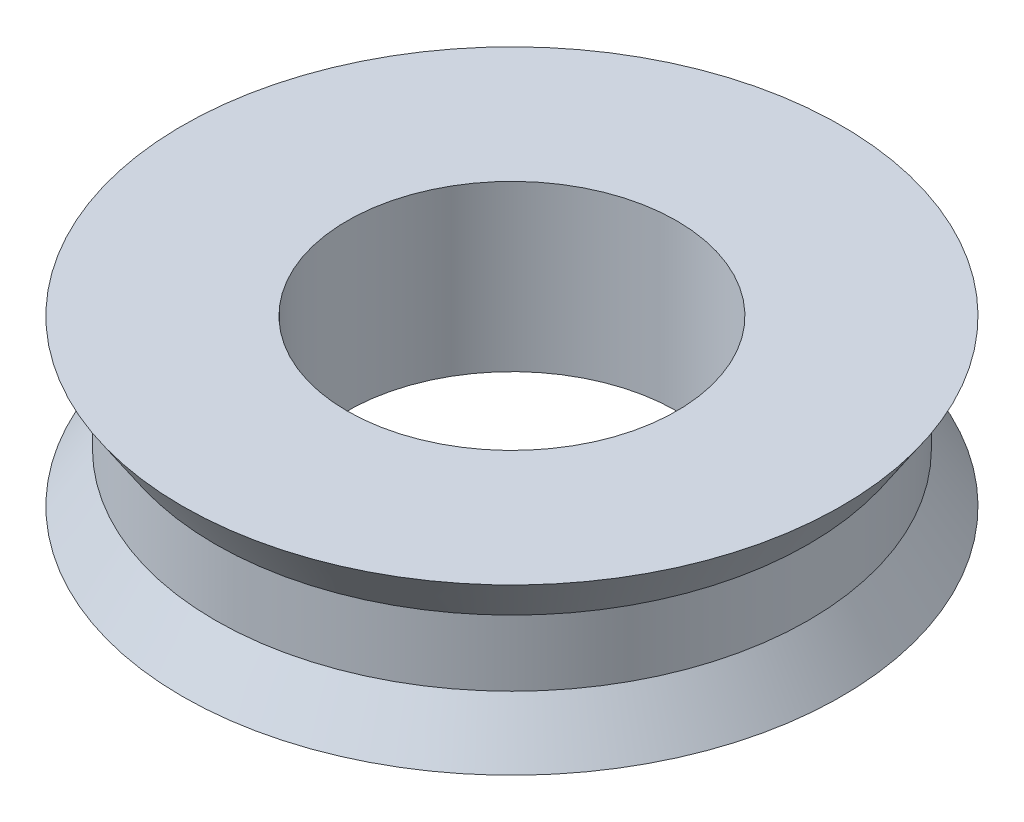
from build123d import *


with BuildPart() as part:
    # Sketch1 → Revolve1 (revolve)
    with BuildSketch(Plane.XY, mode=Mode.PRIVATE) as revolve1_sk:
        Polygon((-11.43, 3.175), (-6.35, 3.175), (-6.35, 6.35), (-12.7, 6.35), (-11.43, 4.445), align=None)
        Polygon((-12.7, 0), (-6.35, 0), (-6.35, 3.175), (-11.43, 3.175), (-11.43, 1.905), align=None)
    revolve(revolve1_sk.sketch.rotate(Axis((0, 6.35, 0), (0, -1, 0)), 270), axis=Axis((0, 6.35, 0), (0, -1, 0)))


solid = part.part
